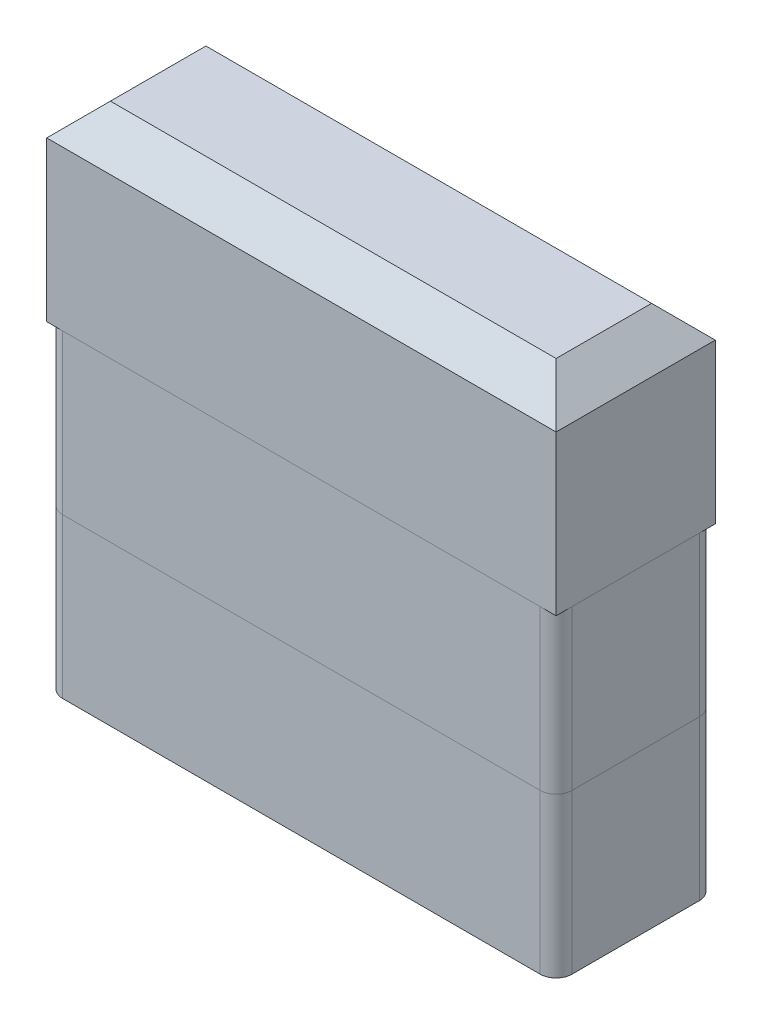
from build123d import *

# Parameters (mm, degrees)
SKETCH1_W           = 160
SKETCH1_H           = 50
BOSS_EXTRUDE1_DEPTH = 160
CHAMFER1_SIZE       = 10
FILLET2_R           = 5
FILLET3_R           = 5


with BuildPart() as part:
    # Sketch1 → Boss-Extrude1 (new body)
    with BuildSketch(Plane(origin=(0, 0, 0), x_dir=(1, 0, 0), z_dir=(0, 1, 0))):
        Rectangle(SKETCH1_W, SKETCH1_H)
    extrude(amount=BOSS_EXTRUDE1_DEPTH)

    # Chamfer1
    chamfer1_edges = [part.edges().sort_by_distance(p)[0] for p in [
        (-80, 160, 0),
        (0, 160, 25),
        (80, 160, 0),
        (0, 160, -25),
    ]]
    chamfer(chamfer1_edges, length=CHAMFER1_SIZE)


with BuildPart() as body_2:
    # Split1: the piece on the far side of the plane
    add(part.part)
    split(bisect_by=Plane.ZX.offset(50), keep=Keep.BOTTOM)

    # Fillet2
    fillet2_edges = [body_2.edges().sort_by_distance(p)[0] for p in [
        (80, 25, 25),
        (-80, 25, 25),
        (-80, 25, -25),
        (80, 25, -25),
    ]]
    fillet(fillet2_edges, radius=FILLET2_R)


with BuildPart() as part_1:
    add(part.part)

    # Split1
    split(bisect_by=Plane.ZX.offset(50), keep=Keep.TOP)


with BuildPart() as body_3:
    # Split2: the piece on the far side of the plane
    add(part_1.part)
    split(bisect_by=Plane.ZX.offset(100), keep=Keep.BOTTOM)

    # Fillet3
    fillet3_edges = [body_3.edges().sort_by_distance(p)[0] for p in [
        (80, 75, 25),
        (-80, 75, 25),
        (-80, 75, -25),
        (80, 75, -25),
    ]]
    fillet(fillet3_edges, radius=FILLET3_R)


with BuildPart() as part_2:
    add(part_1.part)

    # Split2
    split(bisect_by=Plane.ZX.offset(100), keep=Keep.TOP)


solid = Compound([body_2.part, body_3.part, part_2.part])
